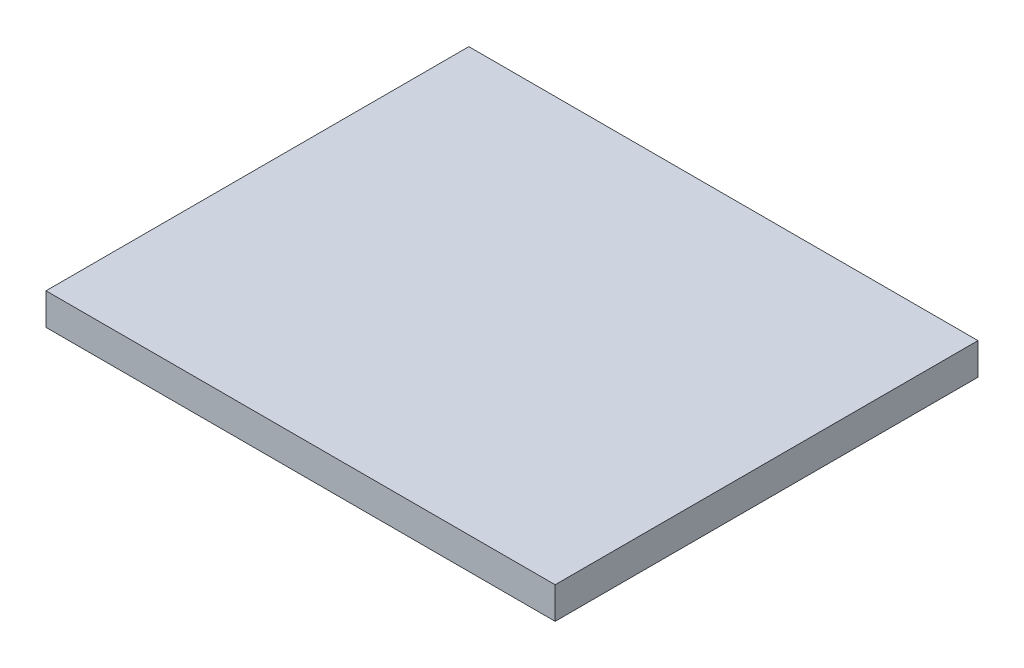
from build123d import *

# Parameters (mm, degrees)
SKETCH1_W           = 16.05
SKETCH1_H           = 13.33
BOSS_EXTRUDE1_DEPTH = 1


with BuildPart() as part:
    # Sketch1 → Boss-Extrude1 (new body)
    with BuildSketch(Plane(origin=(0, 0, 0), x_dir=(1, 0, 0), z_dir=(0, 1, 0))):
        with Locations((8.025, 6.665)):
            Rectangle(SKETCH1_W, SKETCH1_H)
    extrude(amount=BOSS_EXTRUDE1_DEPTH)


solid = part.part
